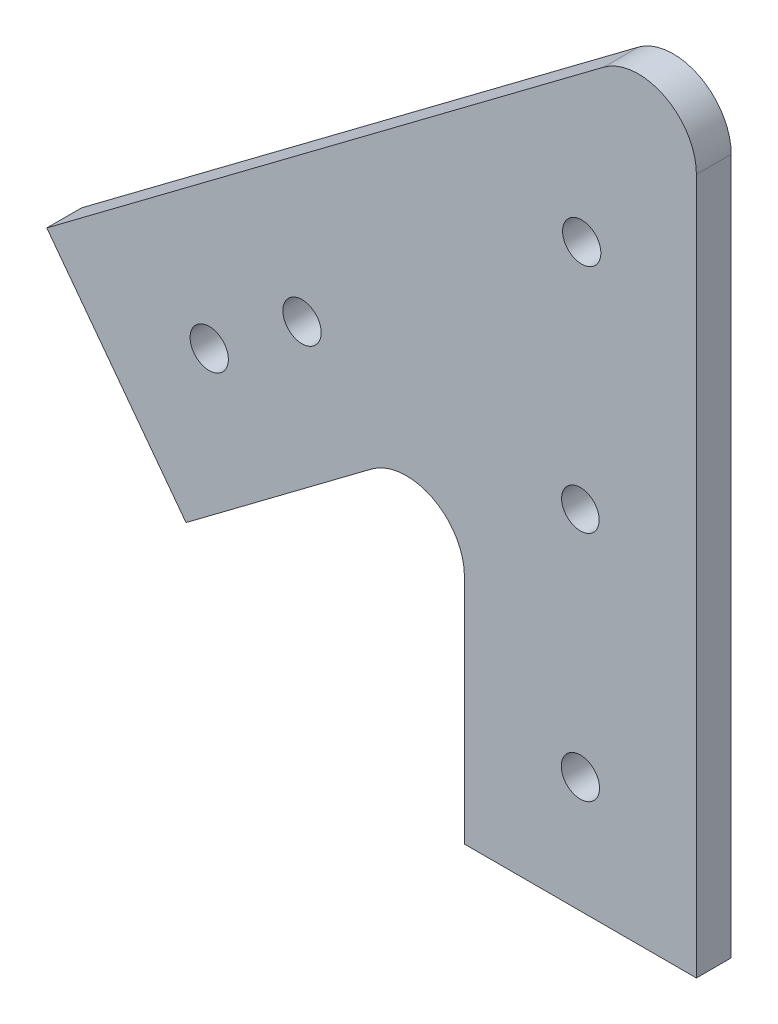
from build123d import *

# Parameters (mm, degrees)
SKETCH_1_R      = 1.65
SKETCH_1_R_2    = 1.620295374
EXTRUDE_1_DEPTH = 3
FILLET_1_R      = 5


with BuildPart() as part:
    # 草图1 → 凸台-拉伸1 (new body)
    with BuildSketch(Plane.XY):
        Polygon((-4.38586222, 10.641032467), (27.611336651, 34.638936735), (27.610889092, -35.358299417), (7.610889171, -35.358299417), (7.614139416, -5.358966306), (-16.385858742, -23.358968761), (-28.385860379, -7.358969988), align=None)
        with Locations((17.724788113, 14.641700583)):
            Circle(SKETCH_1_R, mode=Mode.SUBTRACT)
        with Locations((17.610953032, -5.358299417)):
            Circle(SKETCH_1_R_2, mode=Mode.SUBTRACT)
        with Locations((17.610953032, -25.358299417)):
            Circle(SKETCH_1_R, mode=Mode.SUBTRACT)
        with Locations((-6.385860788, -3.358967738)):
            Circle(SKETCH_1_R, mode=Mode.SUBTRACT)
        with Locations((-14.385860174, -9.358968556)):
            Circle(SKETCH_1_R, mode=Mode.SUBTRACT)
    extrude(amount=EXTRUDE_1_DEPTH)

    # 圆角1
    fillet_1_edges = [part.edges().sort_by_distance(p)[0] for p in [
        (27.611336651, 34.638936735, 1.5),
        (7.614139416, -5.358966306, 1.5),
    ]]
    fillet(fillet_1_edges, radius=FILLET_1_R)


solid = part.part
